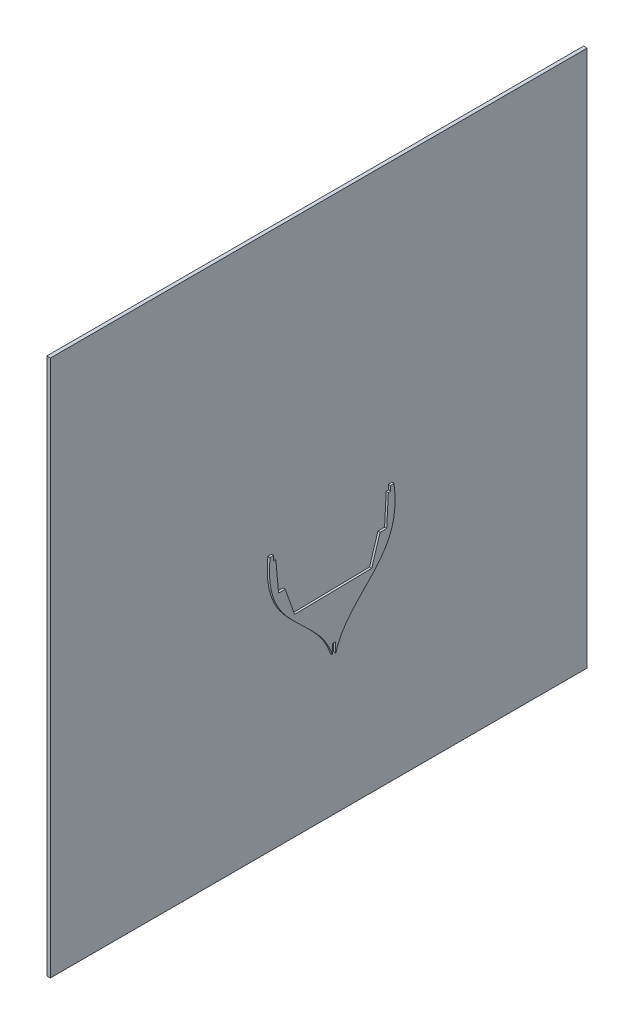
from build123d import *

# Parameters (mm, degrees)
BOSS_EXTRU_2_DEPTH      = 10
BOSS_EXTRU_3_DEPTH      = 6
ENL_V_MAT_EXTRU_1_DEPTH = 6


with BuildPart() as part:
    # Esquisse3D1 → Boss.-Extru.2 (new body)
    with BuildSketch(Plane(origin=(-20, 1121.289346724, 777.274991403), x_dir=(0, -0.7071067811865476, -0.7071067811865476), z_dir=(1, 0, 0))):
        Polygon((0, 0), (1060.66017178, 1060.66017178), (2121.32034356, 0), (1060.66017178, -1060.66017178), align=None)
    extrude(amount=BOSS_EXTRU_2_DEPTH)


with BuildPart() as body_2:
    # Esquisse5 → Boss.-Extru.3 (new body)
    with BuildSketch(Plane(origin=(0, 0, 0), x_dir=(0, 0, -1), z_dir=(1, 0, 0))):
        with BuildLine():
            Line((166.855665561, 353.952391842), (156.855665561, 353.77123807))
            Line((156.855665561, 353.77123807), (157.723181842, 339.701693596))
            Line((157.723181842, 339.701693596), (151.0185207, 339.58023613))
            Line((151.0185207, 339.58023613), (146.47299258, 255.274664597))
            Line((146.47299258, 255.274664597), (127.994738238, 254.939924049))
            Line((127.994738238, 254.939924049), (104.428261476, 179.749987818))
            Line((104.428261476, 179.749987818), (-110.870085369, 175.849777043))
            Line((-110.870085369, 175.849777043), (-137.144394156, 250.13682864))
            Line((-137.144394156, 250.13682864), (-155.622648498, 249.802088092))
            Line((-155.622648498, 249.802088092), (-163.218646637, 333.887711296))
            Line((-163.218646637, 333.887711296), (-169.92330778, 333.76625383))
            Line((-169.92330778, 333.76625383), (-169.565943676, 347.857987474))
            Line((-169.565943676, 347.857987474), (-179.565943676, 347.676833701))
            add(Edge.make_bspline(
                [(0, 0), (-0.449894327, 24.834941105), (-30.033490322, 163.447551845), (-200.919075611, 132.757254742), (-179.565943676, 347.676833701)],
                knots=[0, 0, 0, 0, 0, 1, 1, 1, 1, 1], degree=4))
            add(Edge.make_bspline(
                [(0, 0), (-0.449894327, 24.834941105), (24.093899378, 164.428089929), (195.978931319, 139.94721187), (166.855665561, 353.952391842)],
                knots=[0, 0, 0, 0, 0, 1, 1, 1, 1, 1], degree=4))
        make_face()
    extrude(amount=BOSS_EXTRU_3_DEPTH)

    # Esquisse6 → Enlèv. mat.-Extru.1 (cut)
    with BuildSketch(Plane(origin=(6, 0, 0), x_dir=(0, 0, -1), z_dir=(1, 0, 0))):
        Polygon((-4.956978805, 25.144497254), (-5.446093991, 52.144497254), (3.553906009, 52.307535649), (4.043021195, 25.307535649), (117.063261114, -47.52702125), (-85.227699586, -65.220017949), align=None)
    extrude(amount=-ENL_V_MAT_EXTRU_1_DEPTH, mode=Mode.SUBTRACT)


solid = Compound([part.part, body_2.part])
